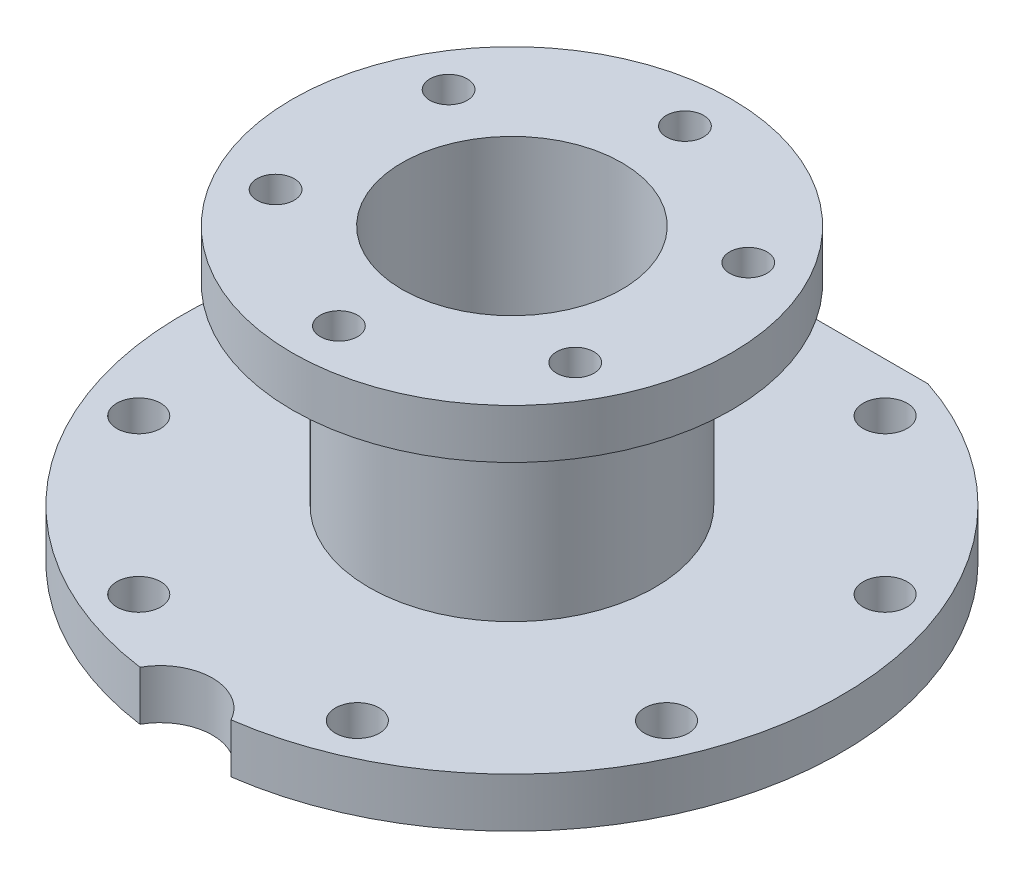
from build123d import *

# Parameters (mm, degrees)
SKETCH_1_R               = 4
EXTRUDE_1_DEPTH          = 9
SKETCH_2_R               = 26
EXTRUDE_2_DEPTH          = 35
SKETCH_3_R               = 40
EXTRUDE_3_DEPTH          = 9
HOLE_WIZARD_M8_1_D       = 6.8
HOLE_WIZARD_M8_1_DEPTH   = 9
PATTERN_CIRCULAR_1_COUNT = 6
SKETCH_6_R               = 20
CUT_EXTRUDE_1_DEPTH      = 100.700603114
SKETCH_7_R               = 37.5
CUT_EXTRUDE_2_DEPTH      = 6
SKETCH_8_R               = 1.5
CUT_EXTRUDE_3_DEPTH      = 100.700603114


with BuildPart() as part:
    # 草图1 → 凸台-拉伸1 (new body)
    with BuildSketch(Plane(origin=(0, 0, 0), x_dir=(1, 0, 0), z_dir=(0, 1, 0))):
        with BuildLine():
            Line((-18.734993995, 57), (18.734993995, 57))
            ThreePointArc((18.734993995, 57), (59.760164517, -5.359359749), (8.293957962, -59.423987255))
            ThreePointArc((8.293957962, -59.423987255), (0, -54.527427418), (-8.293957962, -59.423987255))
            ThreePointArc((-8.293957962, -59.423987255), (-59.760164517, -5.359359749), (-18.734993995, 57))
        make_face()
        with Locations(Location((-48.041735691, 19.899538483, 0), (0, 0, 270))):
            Circle(SKETCH_1_R, mode=Mode.SUBTRACT)
        with Locations(Location((-19.899538483, 48.041735691, 0), (0, 0, 270))):
            Circle(SKETCH_1_R, mode=Mode.SUBTRACT)
        with Locations(Location((19.899538483, 48.041735691, 0), (0, 0, 270))):
            Circle(SKETCH_1_R, mode=Mode.SUBTRACT)
        with Locations(Location((48.041735691, 19.899538483, 0), (0, 0, 270))):
            Circle(SKETCH_1_R, mode=Mode.SUBTRACT)
        with Locations(Location((48.041735691, -19.899538483, 0), (0, 0, 270))):
            Circle(SKETCH_1_R, mode=Mode.SUBTRACT)
        with Locations(Location((19.899538483, -48.041735691, 0), (0, 0, 270))):
            Circle(SKETCH_1_R, mode=Mode.SUBTRACT)
        with Locations(Location((-19.899538483, -48.041735691, 0), (0, 0, 270))):
            Circle(SKETCH_1_R, mode=Mode.SUBTRACT)
        with Locations(Location((-48.041735691, -19.899538483, 0), (0, 0, 270))):
            Circle(SKETCH_1_R, mode=Mode.SUBTRACT)
    extrude(amount=EXTRUDE_1_DEPTH)

    # 草图2 → 凸台-拉伸2 (add)
    with BuildSketch(Plane(origin=(0, 9, 0), x_dir=(1, 0, 0), z_dir=(0, 1, 0))):
        with Locations(Location((0, 0, 0), (0, 0, 270))):
            Circle(SKETCH_2_R)
    extrude(amount=EXTRUDE_2_DEPTH)

    # 草图3 → 凸台-拉伸3 (add)
    with BuildSketch(Plane(origin=(0, 44, 0), x_dir=(1, 0, 0), z_dir=(0, 1, 0))):
        with Locations(Location((0, 0, 0), (0, 0, 270))):
            Circle(SKETCH_3_R)
    extrude(amount=EXTRUDE_3_DEPTH)

    # M8 螺纹孔1
    with Locations(Plane(origin=(0, 53, 0), x_dir=(1, 0, 0), z_dir=(0, 1, 0))):
        with Locations((0, 31.5)):
            hole_wizard_m8_1 = Hole(HOLE_WIZARD_M8_1_D / 2, depth=HOLE_WIZARD_M8_1_DEPTH)

    # 阵列(圆周)1: M8 螺纹孔1 ×6 about axis
    pattern_circular_1_axis = Axis((0, 0, 0), (0, 1, 0))
    for i in range(1, PATTERN_CIRCULAR_1_COUNT):
        add(hole_wizard_m8_1.rotate(pattern_circular_1_axis, i * 360 / PATTERN_CIRCULAR_1_COUNT), mode=Mode.SUBTRACT)

    # 草图6 → 切除-拉伸1 (cut, through all)
    with BuildSketch(Plane(origin=(0, 53, 0), x_dir=(1, 0, 0), z_dir=(0, 1, 0))):
        with Locations(Location((0, 0, 0), (0, 0, 270))):
            Circle(SKETCH_6_R)
    extrude(amount=-CUT_EXTRUDE_1_DEPTH, mode=Mode.SUBTRACT)

    # 草图7 → 切除-拉伸2 (cut)
    with BuildSketch(Plane.XZ):
        with Locations(Location((0, 0, 0), (0, 0, 270))):
            Circle(SKETCH_7_R)
    extrude(amount=-CUT_EXTRUDE_2_DEPTH, mode=Mode.SUBTRACT)

    # 草图8 → 切除-拉伸3 (cut, through all)
    with BuildSketch(Plane(origin=(0, 53, 0), x_dir=(1, 0, 0), z_dir=(0, 1, 0))):
        with Locations(Location((0, 31.5, 0), (0, 0, 270))):
            Circle(SKETCH_8_R)
    extrude(amount=-CUT_EXTRUDE_3_DEPTH, mode=Mode.SUBTRACT)


solid = part.part
